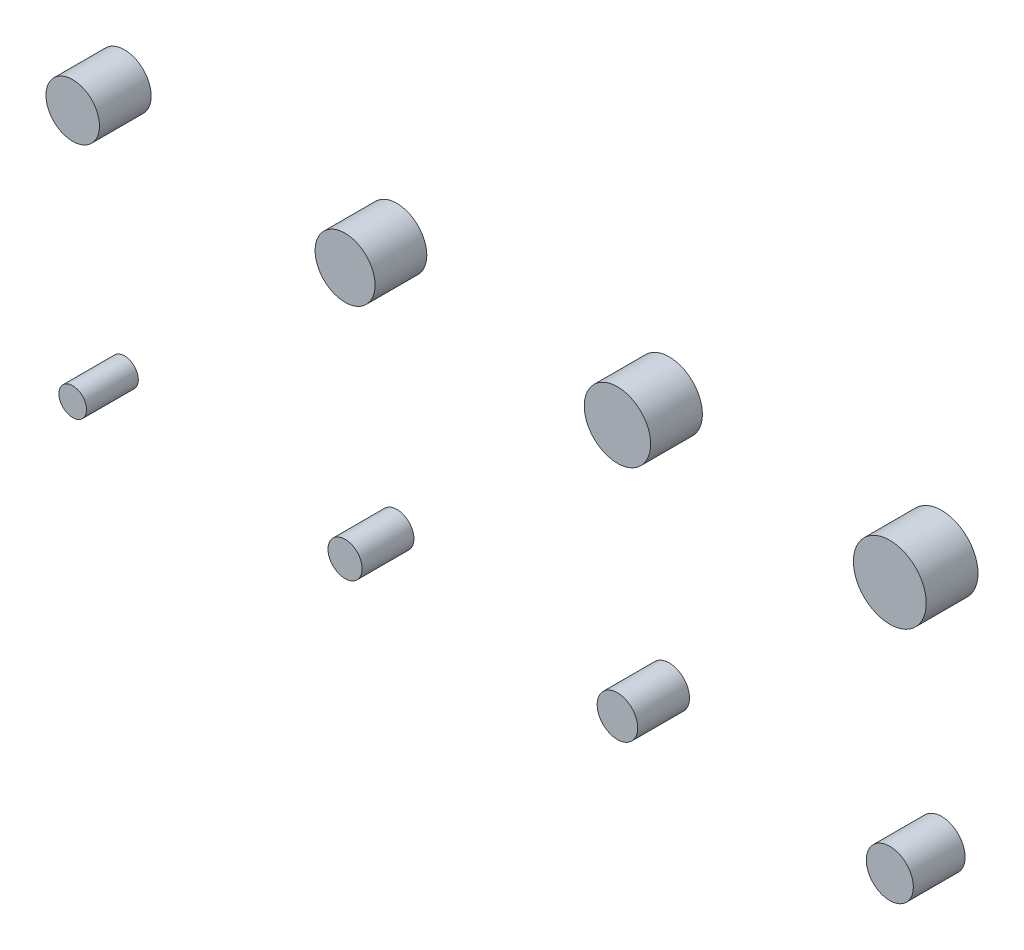
from build123d import *

# Parameters (mm, degrees)
CURVESKETCH_R     = 3.137
CURVEBOSS_DEPTH   = 11.731
CURVESKETCH_R_2   = 3.868
CURVEBOSS_2_DEPTH = 11.731
CURVESKETCH_R_3   = 4.599
CURVEBOSS_3_DEPTH = 11.731
CURVESKETCH_R_4   = 5.33
CURVEBOSS_4_DEPTH = 11.731
CURVESKETCH_R_5   = 6.061
CURVEBOSS_5_DEPTH = 11.731
CURVESKETCH_R_6   = 6.792
CURVEBOSS_6_DEPTH = 11.731
CURVESKETCH_R_7   = 7.523
CURVEBOSS_7_DEPTH = 11.731
CURVESKETCH_R_8   = 8.254
CURVEBOSS_8_DEPTH = 11.731


with BuildPart() as part:
    # CurveSketch → CurveBoss (new body)
    with BuildSketch(Plane.XY):
        with Locations((-87.193, -23.719)):
            Circle(CURVESKETCH_R)
    extrude(amount=CURVEBOSS_DEPTH)


with BuildPart() as body_2:
    # CurveSketch → CurveBoss 2 (new body)
    with BuildSketch(Plane.XY):
        with Locations((-25.474, -23.719)):
            Circle(CURVESKETCH_R_2)
    extrude(amount=CURVEBOSS_2_DEPTH)


with BuildPart() as body_3:
    # CurveSketch → CurveBoss 3 (new body)
    with BuildSketch(Plane.XY):
        with Locations((36.245, -23.719)):
            Circle(CURVESKETCH_R_3)
    extrude(amount=CURVEBOSS_3_DEPTH)


with BuildPart() as body_4:
    # CurveSketch → CurveBoss 4 (new body)
    with BuildSketch(Plane.XY):
        with Locations((97.964, -23.719)):
            Circle(CURVESKETCH_R_4)
    extrude(amount=CURVEBOSS_4_DEPTH)


with BuildPart() as body_5:
    # CurveSketch → CurveBoss 5 (new body)
    with BuildSketch(Plane.XY):
        with Locations((-87.193, 33.418)):
            Circle(CURVESKETCH_R_5)
    extrude(amount=CURVEBOSS_5_DEPTH)


with BuildPart() as body_6:
    # CurveSketch → CurveBoss 6 (new body)
    with BuildSketch(Plane.XY):
        with Locations((-25.474, 33.418)):
            Circle(CURVESKETCH_R_6)
    extrude(amount=CURVEBOSS_6_DEPTH)


with BuildPart() as body_7:
    # CurveSketch → CurveBoss 7 (new body)
    with BuildSketch(Plane.XY):
        with Locations((36.245, 33.418)):
            Circle(CURVESKETCH_R_7)
    extrude(amount=CURVEBOSS_7_DEPTH)


with BuildPart() as body_8:
    # CurveSketch → CurveBoss 8 (new body)
    with BuildSketch(Plane.XY):
        with Locations((97.964, 33.418)):
            Circle(CURVESKETCH_R_8)
    extrude(amount=CURVEBOSS_8_DEPTH)


solid = Compound([part.part, body_2.part, body_3.part, body_4.part, body_5.part, body_6.part, body_7.part, body_8.part])
